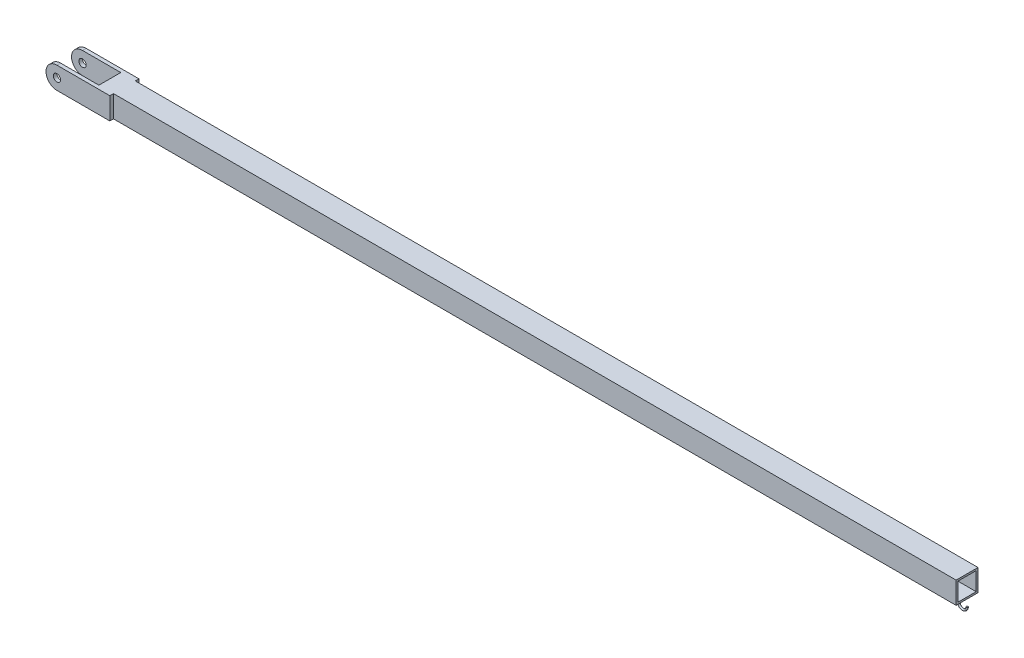
from build123d import *

# Parameters (mm, degrees)
SKETCH2_W           = 38.1
SKETCH2_H           = 38.1
BOSS_EXTRUDE1_DEPTH = 1492.25
SHELL1_T            = -3.175
BOSS_EXTRUDE2_DEPTH = 6.35
SKETCH4_R           = 6.35
CUT_EXTRUDE1_DEPTH  = 1579.907420695
SKETCH7_R           = 1.5875


with BuildPart() as part:
    # Sketch2 → Boss-Extrude1 (new body)
    with BuildSketch(Plane(origin=(0, 0, 0), x_dir=(0, 0, -1), z_dir=(1, 0, 0))):
        Rectangle(SKETCH2_W, SKETCH2_H)
    extrude(amount=-BOSS_EXTRUDE1_DEPTH)

    # Shell1
    shell1_openings = [part.faces().sort_by_distance(p)[0] for p in [
        (0, 0, 0),
        (-1492.25, 0, 0),
    ]]
    offset(amount=SHELL1_T, openings=shell1_openings, kind=Kind.INTERSECTION)

    # Sketch3 → Boss-Extrude2 (add)
    with BuildSketch(Plane.XY.offset(19.05)):
        with BuildLine():
            Line((-1492.25, 19.05), (-1466.85, 19.05))
            Line((-1466.85, 19.05), (-1466.85, -19.05))
            Line((-1466.85, -19.05), (-1492.25, -19.05))
            Line((-1492.25, -19.05), (-1558.925, -19.05))
            ThreePointArc((-1558.925, -19.05), (-1577.975, 0), (-1558.925, 19.05))
            Line((-1558.925, 19.05), (-1492.25, 19.05))
        make_face()
    boss_extrude2 = extrude(amount=BOSS_EXTRUDE2_DEPTH)

    # Mirror1: Boss-Extrude2 across plane
    add(boss_extrude2.mirror(Plane.XY))

    # Sketch4 → Cut-Extrude1 (cut, through all)
    with BuildSketch(Plane.XY.offset(25.4)):
        with Locations((-1558.925, 0)):
            Circle(SKETCH4_R)
    extrude(amount=-CUT_EXTRUDE1_DEPTH, mode=Mode.SUBTRACT)

    # Sweep1: sweep along a path in Sketch5
    with BuildLine(Plane.XY) as sweep1_path:
        Line((-14.2875, -19.05), (-14.2875, -30.95625))
        ThreePointArc((-14.2875, -30.95625), (-7.14375, -38.1), (0, -30.95625))
    # Sketch7 → Sweep1 (sweep)
    with BuildSketch(Plane.XZ.offset(19.05)):
        with Locations((-14.2875, 0)):
            Circle(SKETCH7_R)
    sweep(path=sweep1_path.line)


solid = part.part
